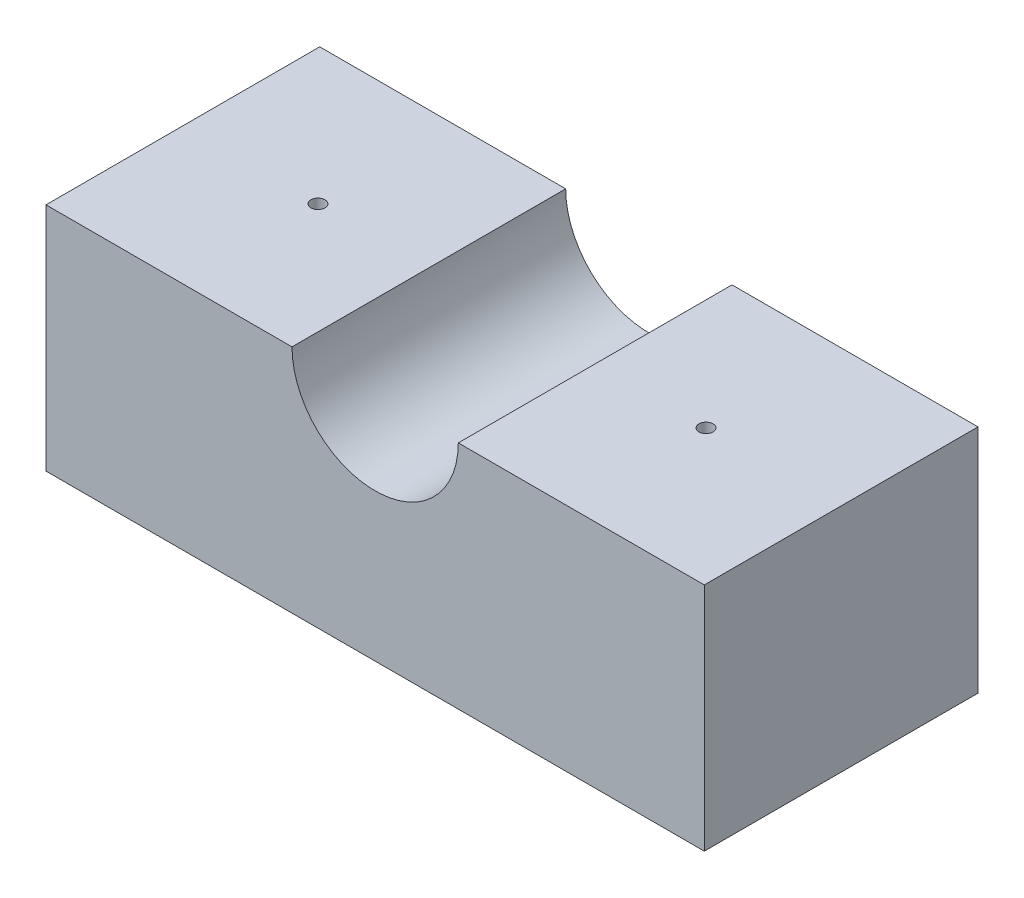
from build123d import *

# Parameters (mm, degrees)
SKETCH2_W           = 23.74600026
SKETCH2_H           = 9.873000066
BOSS_EXTRUDE1_DEPTH = 8.3185
SKETCH3_R           = 2.99974
CUT_EXTRUDE1_DEPTH  = 18.539717918
SKETCH4_R           = 0.254
CUT_EXTRUDE2_DEPTH  = 2.54


with BuildPart() as part:
    # Sketch2 → Boss-Extrude1 (new body)
    with BuildSketch(Plane(origin=(0, 0, 0), x_dir=(1, 0, 0), z_dir=(0, 1, 0))):
        Rectangle(SKETCH2_W, SKETCH2_H)
    extrude(amount=BOSS_EXTRUDE1_DEPTH)

    # Sketch3 → Cut-Extrude1 (cut, through all)
    with BuildSketch(Plane.XY.offset(4.936500033)):
        with Locations((0, 8.3185)):
            Circle(SKETCH3_R)
    extrude(amount=-CUT_EXTRUDE1_DEPTH, mode=Mode.SUBTRACT)

    # Sketch4 → Cut-Extrude2 (cut)
    with BuildSketch(Plane(origin=(0, 8.3185, 0), x_dir=(1, 0, 0), z_dir=(0, 1, 0))):
        with Locations(Location((-6.99999997, 0, 0), (0, 0, 270))):
            Circle(SKETCH4_R)
        with Locations(Location((6.99999997, 0, 0), (0, 0, 90))):
            Circle(SKETCH4_R)
    extrude(amount=-CUT_EXTRUDE2_DEPTH, mode=Mode.SUBTRACT)


solid = part.part
